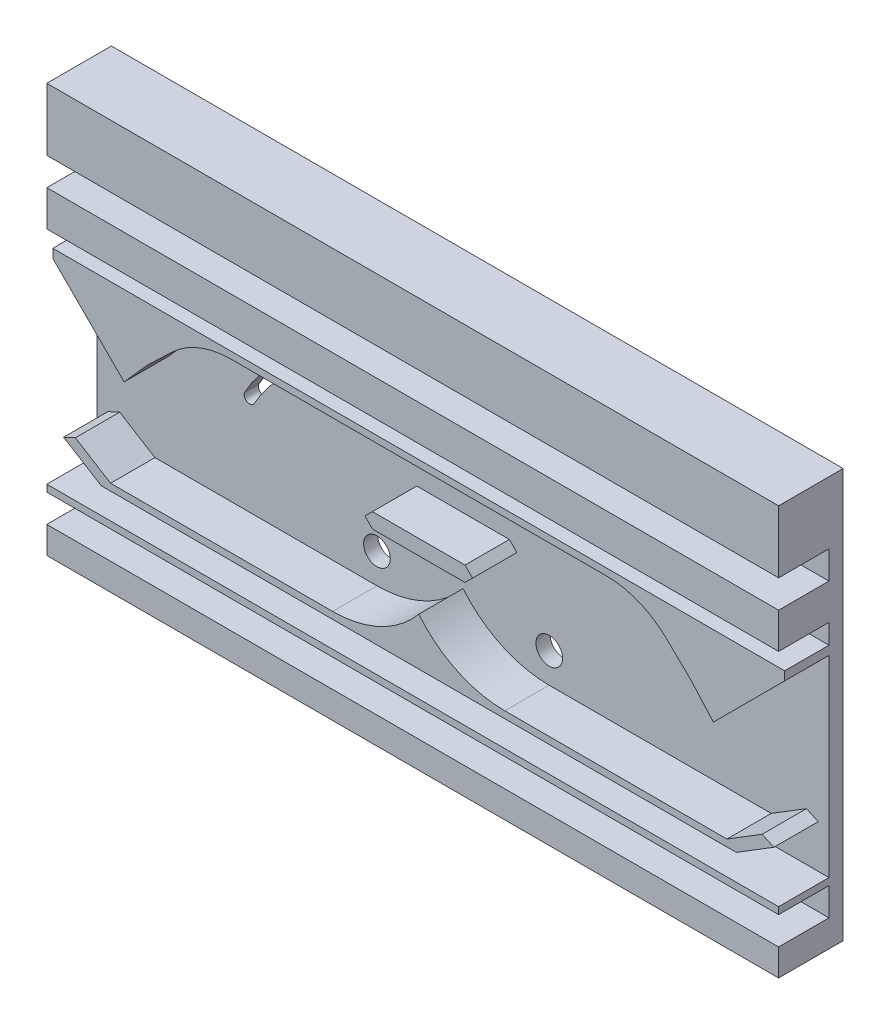
from build123d import *

# Parameters (mm, degrees)
SKETCH3_W          = 215.9
SKETCH3_H          = 120.65
EXTRUDE1_DEPTH     = 4.191
SKETCH4_W          = 215.9
SKETCH4_H          = 18.415
SKETCH4_H_2        = 10.541
SKETCH4_H_3        = 7.9375
SKETCH4_H_4        = 2.032
EXTRUDE2_DEPTH     = 19.05
EXTRUDE3_DEPTH     = 17.272
SKETCH8_R          = 3.937
SKETCH8_R_2        = 1.1303
CUT_EXTRUDE1_DEPTH = 19.05


with BuildPart() as part:
    # Sketch3 → Extrude1 (new body)
    with BuildSketch(Plane.XY):
        with Locations((381, 95.25)):
            Rectangle(SKETCH3_W, SKETCH3_H)
    extrude(amount=EXTRUDE1_DEPTH)

    # Sketch4 → Extrude2 (add)
    with BuildSketch(Plane.XY):
        with Locations((381, 146.3675)):
            Rectangle(SKETCH4_W, SKETCH4_H)
        with Locations((381, 123.6345)):
            Rectangle(SKETCH4_W, SKETCH4_H_2)
        with Locations((381, 38.89375)):
            Rectangle(SKETCH4_W, SKETCH4_H_3)
        with Locations((381, 52.1335)):
            Rectangle(SKETCH4_W, SKETCH4_H_4)
    extrude(amount=EXTRUDE2_DEPTH)

    # Sketch5 → Extrude3 (add)
    with BuildSketch(Plane.XY):
        with BuildLine():
            Line((381, 58.9915), (287.3375, 58.9915))
            Line((287.3375, 58.9915), (276.225, 65.8495))
            Line((276.225, 65.8495), (279.698182312, 67.437))
            Line((279.698182312, 67.437), (290.090427682, 61.0235))
            Line((290.090427682, 61.0235), (355.6, 61.0235))
            ThreePointArc((355.6, 61.0235), (369.646316263, 64.174903412), (381.000000001, 73.025))
            ThreePointArc((381.000000001, 73.025), (392.353683737, 64.174903412), (406.4, 61.0235))
            Line((406.4, 61.0235), (471.909572318, 61.0235))
            Line((471.909572318, 61.0235), (482.301817688, 67.437))
            Line((482.301817688, 67.437), (485.775, 65.8495))
            Line((485.775, 65.8495), (474.6625, 58.9915))
            Line((474.6625, 58.9915), (381, 58.9915))
        make_face()
        Polygon((381, 87.9475), (367.3475, 87.9475), (365.125, 90.17), (367.3475, 92.3925), (381, 92.3925), (394.6525, 92.3925), (396.875, 90.17), (394.6525, 87.9475), align=None)
        with BuildLine():
            Line((436.382792366, 110.49), (325.617207634, 110.49))
            ThreePointArc((325.617207634, 110.49), (316.127546422, 108.650694601), (308.012246242, 103.399159848))
            Line((308.012246242, 103.399159848), (300.99, 96.647))
            Line((300.99, 96.647), (294.082258334, 88.9))
            Line((294.082258334, 88.9), (273.05, 109.932258334))
            Line((273.05, 109.932258334), (273.05, 112.522))
            Line((273.05, 112.522), (488.95, 112.522))
            Line((488.95, 112.522), (488.95, 109.932258334))
            Line((488.95, 109.932258334), (467.917741666, 88.9))
            Line((467.917741666, 88.9), (461.01, 96.647))
            Line((461.01, 96.647), (453.987753758, 103.399159848))
            ThreePointArc((453.987753758, 103.399159848), (445.872453578, 108.650694601), (436.382792366, 110.49))
        make_face()
    extrude(amount=EXTRUDE3_DEPTH)

    # Sketch8 → Cut-Extrude1 (cut)
    with BuildSketch(Plane.XY):
        with Locations((355.582497028, 69.847540117)):
            Circle(SKETCH8_R)
        with Locations((406.417502972, 69.847540117)):
            Circle(SKETCH8_R)
        with Locations((381, 46.99)):
            Circle(SKETCH8_R_2)
        with Locations((460.95285, 46.99)):
            Circle(SKETCH8_R_2)
        with Locations((301.04715, 46.99)):
            Circle(SKETCH8_R_2)
        with BuildLine():
            ThreePointArc((319.409826978, 89.545574531), (322.509420435, 94.391866743), (326.25811196, 98.755505093))
            ThreePointArc((326.25811196, 98.755505093), (326.161980776, 101.078429217), (323.852023449, 100.815152101))
            ThreePointArc((323.852023449, 100.815152101), (319.896382713, 96.191952728), (316.621455618, 91.063998107))
            ThreePointArc((316.621455618, 91.063998107), (317.25642951, 88.910600639), (319.409826978, 89.545574531))
        make_face()
        with BuildLine():
            ThreePointArc((438.147976551, 100.815152101), (442.103617287, 96.191952728), (445.378544382, 91.063998107))
            ThreePointArc((445.378544382, 91.063998107), (444.74357049, 88.910600639), (442.590173022, 89.545574531))
            ThreePointArc((442.590173022, 89.545574531), (439.490579565, 94.391866743), (435.74188804, 98.755505093))
            ThreePointArc((435.74188804, 98.755505093), (435.838019224, 101.078429217), (438.147976551, 100.815152101))
        make_face()
    extrude(amount=CUT_EXTRUDE1_DEPTH, mode=Mode.SUBTRACT)


solid = part.part
